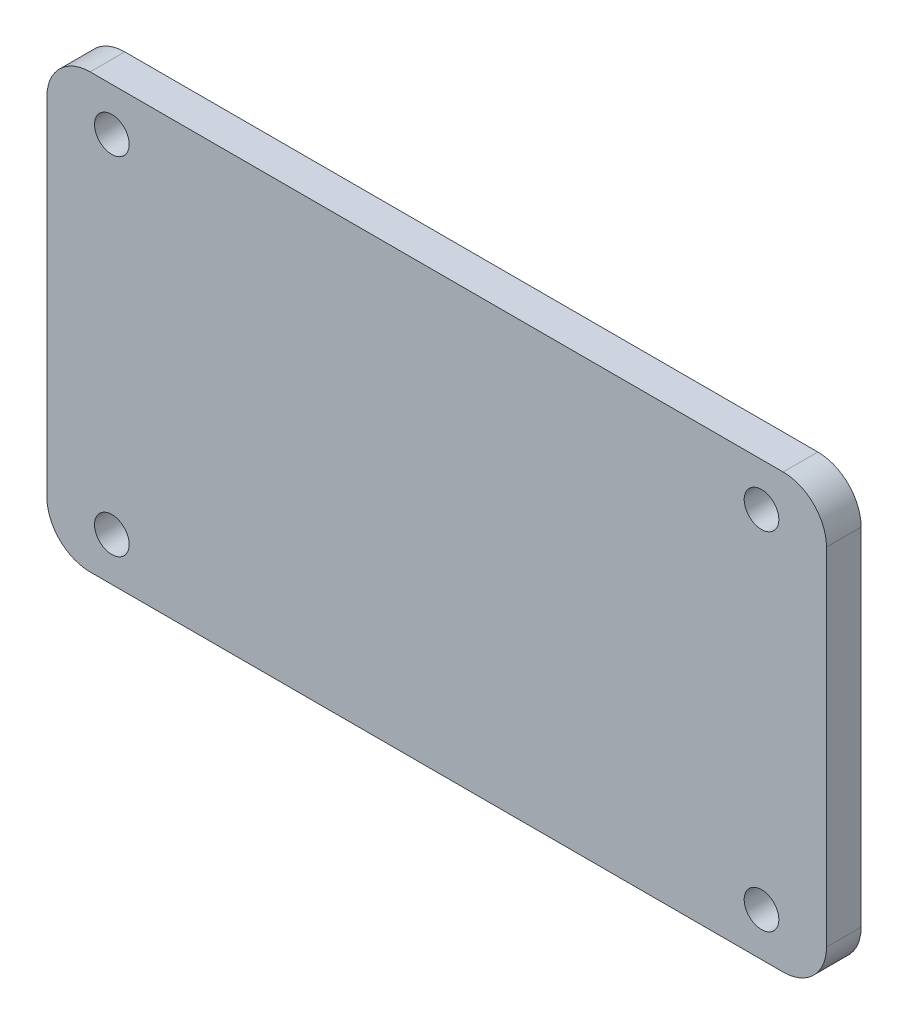
from build123d import *

# Parameters (mm, degrees)
SKETCH_1_W      = 90
SKETCH_1_H      = 50
SKETCH_1_R      = 2
EXTRUDE_1_DEPTH = 4
FILLET_1_R      = 5


with BuildPart() as part:
    # 草图1 → 凸台-拉伸1 (new body)
    with BuildSketch(Plane.XY):
        Rectangle(SKETCH_1_W, SKETCH_1_H)
        with Locations((-37.5, 20)):
            Circle(SKETCH_1_R, mode=Mode.SUBTRACT)
        with Locations((-37.5, -20)):
            Circle(SKETCH_1_R, mode=Mode.SUBTRACT)
        with Locations((37.5, -20)):
            Circle(SKETCH_1_R, mode=Mode.SUBTRACT)
        with Locations((37.5, 20)):
            Circle(SKETCH_1_R, mode=Mode.SUBTRACT)
    extrude(amount=EXTRUDE_1_DEPTH)

    # 圆角1
    fillet_1_edges = [part.edges().sort_by_distance(p)[0] for p in [
        (45, -25, 2),
        (-45, -25, 2),
        (-45, 25, 2),
        (45, 25, 2),
    ]]
    fillet(fillet_1_edges, radius=FILLET_1_R)


solid = part.part
